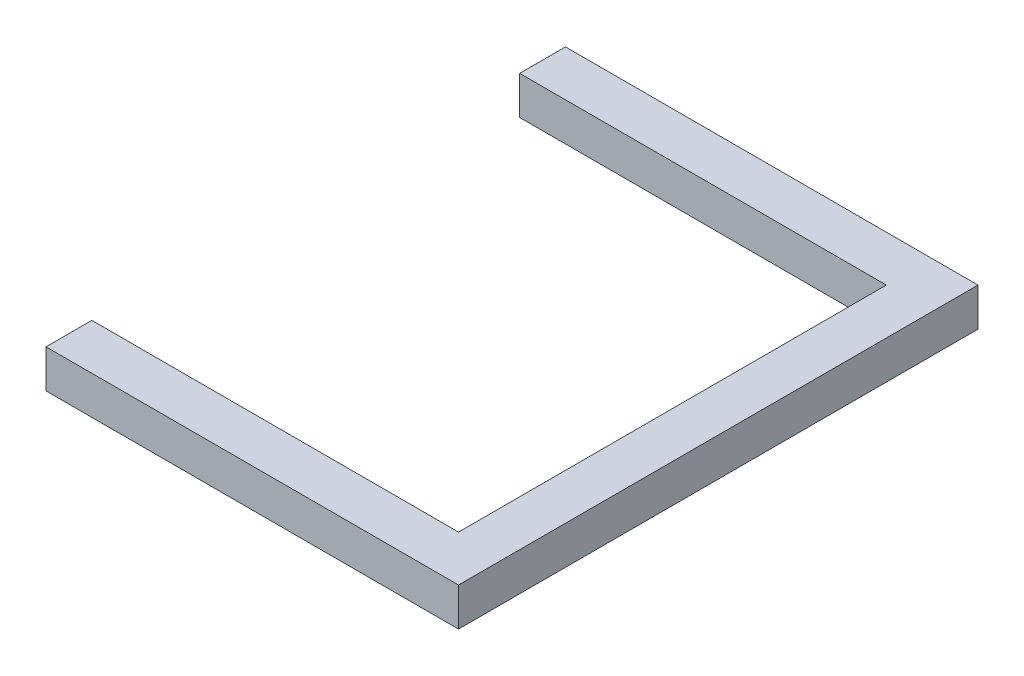
from build123d import *

# Parameters (mm, degrees)
BOSS_EXTRUDE1_DEPTH = 2.5


with BuildPart() as part:
    # Sketch1 → Boss-Extrude1 (new body)
    with BuildSketch(Plane(origin=(0, 0, 0), x_dir=(1, 0, 0), z_dir=(0, 1, 0))):
        Polygon((0, 14), (0, -14), (-24, -14), (-24, -17), (3, -17), (3, 17), (-24, 17), (-24, 14), align=None)
    extrude(amount=BOSS_EXTRUDE1_DEPTH)


solid = part.part
